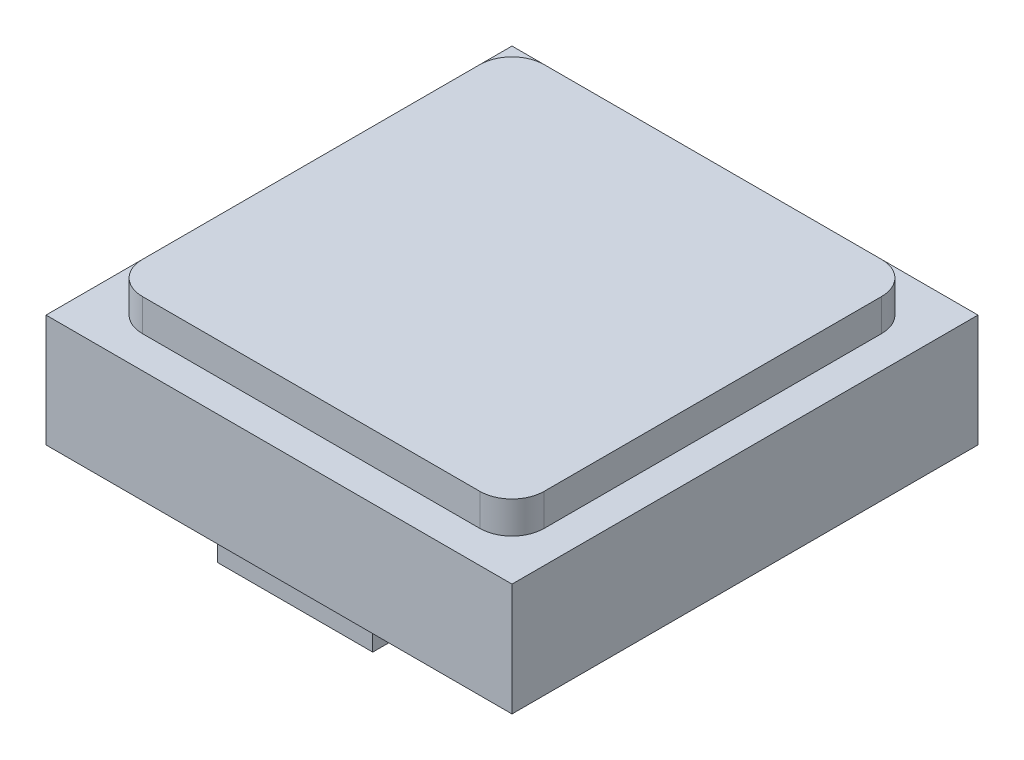
from build123d import *

# Parameters (mm, degrees)
SKETCH1_W           = 29
SKETCH1_H           = 29
BOSS_EXTRUDE1_DEPTH = 11
CUT_EXTRUDE1_DEPTH  = 2
SKETCH3_W           = 29
SKETCH3_H           = 29
SKETCH3_W_2         = 25
SKETCH3_H_2         = 18
CUT_EXTRUDE2_DEPTH  = 2
SKETCH4_W           = 9.666666666
SKETCH4_H           = 4
BOSS_EXTRUDE2_DEPTH = 2


with BuildPart() as part:
    # Sketch1 → Boss-Extrude1 (new body)
    with BuildSketch(Plane(origin=(0, 0, 0), x_dir=(1, 0, 0), z_dir=(0, 1, 0))):
        Rectangle(SKETCH1_W, SKETCH1_H)
    extrude(amount=BOSS_EXTRUDE1_DEPTH)

    # Sketch2 → Cut-Extrude1 (cut)
    with BuildSketch(Plane(origin=(0, 11, 0), x_dir=(1, 0, 0), z_dir=(0, 1, 0))):
        with BuildLine():
            Line((-10.5, 17.5), (10.5, 17.5))
            ThreePointArc((10.5, 17.5), (15.449747468, 15.449747468), (17.5, 10.5))
            Line((17.5, 10.5), (17.5, -10.5))
            ThreePointArc((17.5, -10.5), (15.449747468, -15.449747468), (10.5, -17.5))
            Line((10.5, -17.5), (-10.5, -17.5))
            ThreePointArc((-10.5, -17.5), (-15.449747468, -15.449747468), (-17.5, -10.5))
            Line((-17.5, -10.5), (-17.5, 10.5))
            ThreePointArc((-17.5, 10.5), (-15.449747468, 15.449747468), (-10.5, 17.5))
        make_face()
        with BuildLine():
            Line((-10.5, 12.5), (10.5, 12.5))
            ThreePointArc((10.5, 12.5), (11.914213562, 11.914213562), (12.5, 10.5))
            Line((12.5, 10.5), (12.5, -10.5))
            ThreePointArc((12.5, -10.5), (11.914213562, -11.914213562), (10.5, -12.5))
            Line((10.5, -12.5), (-10.5, -12.5))
            ThreePointArc((-10.5, -12.5), (-11.914213562, -11.914213562), (-12.5, -10.5))
            Line((-12.5, -10.5), (-12.5, 10.5))
            ThreePointArc((-12.5, 10.5), (-11.914213562, 11.914213562), (-10.5, 12.5))
        make_face(mode=Mode.SUBTRACT)
    extrude(amount=-CUT_EXTRUDE1_DEPTH, mode=Mode.SUBTRACT)

    # Sketch3 → Cut-Extrude2 (cut)
    with BuildSketch(Plane(origin=(0, 0, 0), x_dir=(-1, 0, 0), z_dir=(0, -1, 0))):
        Rectangle(SKETCH3_W, SKETCH3_H)
        with Locations((0, 3.5)):
            Rectangle(SKETCH3_W_2, SKETCH3_H_2, mode=Mode.SUBTRACT)
    extrude(amount=-CUT_EXTRUDE2_DEPTH, mode=Mode.SUBTRACT)

    # Sketch4 → Boss-Extrude2 (add)
    with BuildSketch(Plane.XZ.offset(-2)):
        with Locations((0, 11.5)):
            Rectangle(SKETCH4_W, SKETCH4_H)
    extrude(amount=BOSS_EXTRUDE2_DEPTH)


solid = part.part
